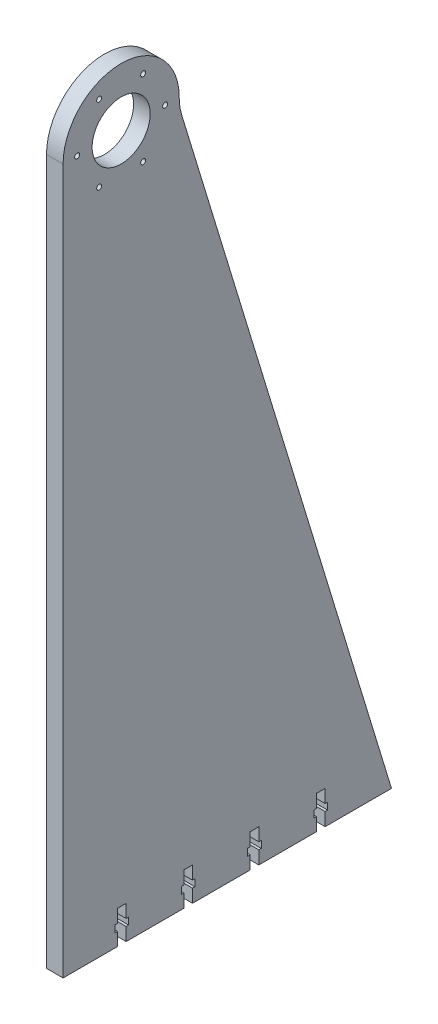
from build123d import *

# Parameters (mm, degrees)
SKETCH_2_R               = 17.5
EXTRUDE_1_DEPTH          = 10
CUT_EXTRUDE_2_DEPTH      = 10
PATTERN_LINEAR_1_COUNT   = 4
PATTERN_LINEAR_1_PITCH   = 40
SKETCH_6_R               = 1.5
CUT_EXTRUDE_3_DEPTH      = 10
PATTERN_CIRCULAR_1_COUNT = 6


with BuildPart() as part:
    # Эскиз2 → Бобышка-Вытянуть1 (new body)
    with BuildSketch(Plane(origin=(0, 0, 0), x_dir=(0, 0, -1), z_dir=(1, 0, 0))):
        with BuildLine():
            Line((0, 425), (0, 0))
            Line((0, 0), (198, 0))
            Line((198, 0), (71.521752772, 414.791818842))
            ThreePointArc((71.521752772, 414.791818842), (70.382528595, 419.839508404), (70, 425))
            ThreePointArc((70, 425), (35, 460), (0, 425))
        make_face()
        with Locations((35, 425)):
            Circle(SKETCH_2_R, mode=Mode.SUBTRACT)
    extrude(amount=EXTRUDE_1_DEPTH)

    # Эскиз3 → Вырез-Вытянуть2 (cut)
    with BuildSketch(Plane.ZY):
        Polygon((-158, 0), (-158, 7.9), (-159.5, 7.9), (-159.5, 12.1), (-158, 12.1), (-158, 20), (-152.8, 20), (-152.8, 12.1), (-151.3, 12.1), (-151.3, 7.9), (-152.8, 7.9), (-152.8, 0), align=None)
    cut_extrude_2 = extrude(amount=-CUT_EXTRUDE_2_DEPTH, mode=Mode.SUBTRACT)

    # Линейный массив1: Вырез-Вытянуть2 ×4
    with Locations(*[(0, 0, i * PATTERN_LINEAR_1_PITCH) for i in range(1, PATTERN_LINEAR_1_COUNT)]):
        add(cut_extrude_2, mode=Mode.SUBTRACT)

    # Эскиз6 → Вырез-Вытянуть3 (cut)
    with BuildSketch(Plane(origin=(10, 0, 0), x_dir=(0, 0, -1), z_dir=(1, 0, 0))):
        with Locations((8.5, 425)):
            Circle(SKETCH_6_R)
    cut_extrude_3 = extrude(amount=-CUT_EXTRUDE_3_DEPTH, mode=Mode.SUBTRACT)

    # Круговой массив1: Вырез-Вытянуть3 ×6 about axis
    pattern_circular_1_axis = Axis((0, 425, -35), (1, 0, 0))
    for i in range(1, PATTERN_CIRCULAR_1_COUNT):
        add(cut_extrude_3.rotate(pattern_circular_1_axis, i * 360 / PATTERN_CIRCULAR_1_COUNT), mode=Mode.SUBTRACT)


solid = part.part
